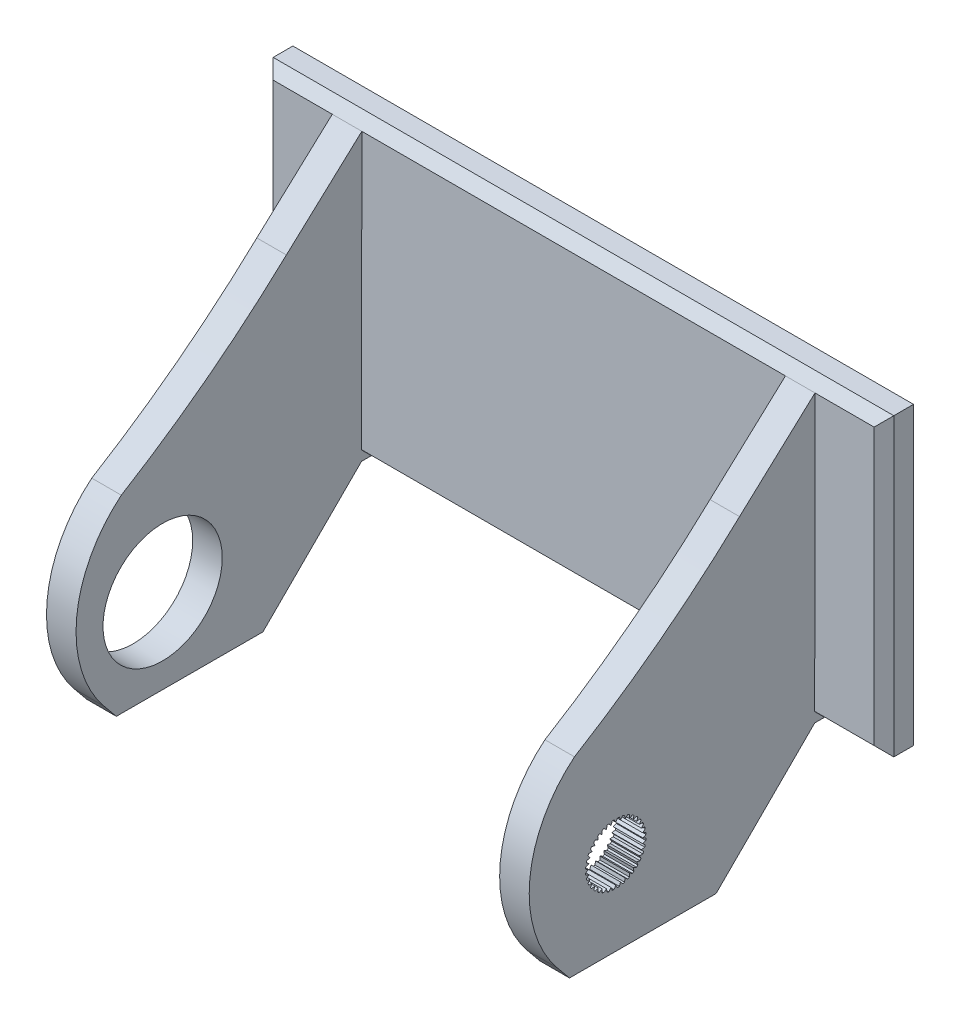
from build123d import *

# Parameters (mm, degrees)
SKETCH2_W           = 63
SKETCH2_H           = 30
BOSS_EXTRUDE2_DEPTH = 3
CHAMFER2_SIZE       = 1
BOSS_EXTRUDE9_DEPTH = 3
CUT_EXTRUDE5_DEPTH  = 5
SKETCH16_R          = 6.05
CUT_EXTRUDE6_DEPTH  = 10


with BuildPart() as part:
    # Sketch2 → Boss-Extrude2 (new body)
    with BuildSketch(Plane.XY):
        Rectangle(SKETCH2_W, SKETCH2_H)
    extrude(amount=BOSS_EXTRUDE2_DEPTH)

    # Chamfer2
    chamfer2_edges = [part.edges().sort_by_distance(p)[0] for p in [
        (31.5, 0, 3),
        (0, 15, 3),
        (-31.5, 0, 3),
        (0, -15, 3),
    ]]
    chamfer(chamfer2_edges, length=CHAMFER2_SIZE)

    # Sketch13 → Boss-Extrude9 (add)
    with BuildSketch(Plane(origin=(24.5, 0, 0), x_dir=(0, 0, -1), z_dir=(1, 0, 0))):
        with BuildLine():
            Line((-10.660322202, 6.959525665), (-2.998872345, 14.001126385))
            Line((-2.998872345, 14.001126385), (-3.030428908, -13.998855833))
            Line((-3.030428908, -13.998855833), (-2.031556563, -14.999982218))
            Line((-2.031556563, -14.999982218), (-3.031555928, -14.998855197))
            Line((-3.031555928, -14.998855197), (-13.042819779, -24.987578645))
            Line((-13.042819779, -24.987578645), (-27.921026388, -24.970810597))
            Line((-27.921026388, -24.970810597), (-29.162872651, -23.456276379))
            ThreePointArc((-29.162872651, -23.456276379), (-31.949395463, -14.255966479), (-27.41416312, -5.779995783))
            ThreePointArc((-27.41416312, -5.779995783), (-18.704473898, 0.152138226), (-10.660322202, 6.959525665))
        make_face()
    boss_extrude9 = extrude(amount=-BOSS_EXTRUDE9_DEPTH)

    # Sketch15 → Cut-Extrude5 (cut)
    with BuildSketch(Plane(origin=(24.5, 0, 0), x_dir=(0, 0, -1), z_dir=(1, 0, 0))):
        with BuildLine():
            Line((-20.762578121, -14.904937587), (-20.716266214, -14.82472301))
            Line((-20.716266214, -14.82472301), (-20.652589668, -14.714431997))
            ThreePointArc((-20.652589668, -14.714431997), (-20.706229612, -14.635227935), (-20.762311144, -14.55773349))
            Line((-20.762311144, -14.55773349), (-20.887729456, -14.579848123))
            Line((-20.887729456, -14.579848123), (-20.978946107, -14.595932079))
            Line((-20.978946107, -14.595932079), (-21.101391144, -14.617522443))
            Line((-21.101391144, -14.617522443), (-21.058866429, -14.500686748))
            Line((-21.058866429, -14.500686748), (-21.027187219, -14.413648833))
            Line((-21.027187219, -14.413648833), (-20.983629896, -14.293976072))
            ThreePointArc((-20.983629896, -14.293976072), (-21.05020857, -14.225289776), (-21.118894866, -14.158711102))
            Line((-21.118894866, -14.158711102), (-21.238567627, -14.202268425))
            Line((-21.238567627, -14.202268425), (-21.325605542, -14.233947635))
            Line((-21.325605542, -14.233947635), (-21.442441237, -14.276472351))
            Line((-21.442441237, -14.276472351), (-21.420850873, -14.154027313))
            Line((-21.420850873, -14.154027313), (-21.404766916, -14.062810662))
            Line((-21.404766916, -14.062810662), (-21.382652284, -13.93739235))
            ThreePointArc((-21.382652284, -13.93739235), (-21.460146729, -13.881310819), (-21.539350791, -13.827670874))
            Line((-21.539350791, -13.827670874), (-21.649641804, -13.89134742))
            Line((-21.649641804, -13.89134742), (-21.72985638, -13.937659328))
            Line((-21.72985638, -13.937659328), (-21.837532739, -13.999826302))
            Line((-21.837532739, -13.999826302), (-21.837532739, -13.875492353))
            Line((-21.837532739, -13.875492353), (-21.837532739, -13.782868538))
            Line((-21.837532739, -13.782868538), (-21.837532739, -13.655515446))
            ThreePointArc((-21.837532739, -13.655515446), (-21.923588325, -13.613742688), (-22.010903578, -13.574671296))
            Line((-22.010903578, -13.574671296), (-22.108461706, -13.656532286))
            Line((-22.108461706, -13.656532286), (-22.179415665, -13.716069726))
            Line((-22.179415665, -13.716069726), (-22.274660996, -13.795990049))
            Line((-22.274660996, -13.795990049), (-22.29625136, -13.673545011))
            Line((-22.29625136, -13.673545011), (-22.312335316, -13.58232836))
            Line((-22.312335316, -13.58232836), (-22.334449949, -13.456910048))
            ThreePointArc((-22.334449949, -13.456910048), (-22.42645192, -13.430715308), (-22.519225334, -13.407399633))
            Line((-22.519225334, -13.407399633), (-22.601086323, -13.504957761))
            Line((-22.601086323, -13.504957761), (-22.660623764, -13.57591172))
            Line((-22.660623764, -13.57591172), (-22.740544086, -13.671157051))
            Line((-22.740544086, -13.671157051), (-22.783068801, -13.554321356))
            Line((-22.783068801, -13.554321356), (-22.814748012, -13.467283441))
            Line((-22.814748012, -13.467283441), (-22.858305335, -13.34761068))
            ThreePointArc((-22.858305335, -13.34761068), (-22.953458258, -13.337789871), (-23.04887096, -13.330938348))
            Line((-23.04887096, -13.330938348), (-23.112547506, -13.441229361))
            Line((-23.112547506, -13.441229361), (-23.158859413, -13.521443937))
            Line((-23.158859413, -13.521443937), (-23.221026388, -13.629120296))
            Line((-23.221026388, -13.629120296), (-23.283193363, -13.521443937))
            Line((-23.283193363, -13.521443937), (-23.32950527, -13.441229361))
            Line((-23.32950527, -13.441229361), (-23.393181816, -13.330938348))
            ThreePointArc((-23.393181816, -13.330938348), (-23.488594518, -13.337789871), (-23.583747442, -13.34761068))
            Line((-23.583747442, -13.34761068), (-23.627304764, -13.467283441))
            Line((-23.627304764, -13.467283441), (-23.658983975, -13.554321356))
            Line((-23.658983975, -13.554321356), (-23.70150869, -13.671157051))
            Line((-23.70150869, -13.671157051), (-23.781429012, -13.57591172))
            Line((-23.781429012, -13.57591172), (-23.840966453, -13.504957761))
            Line((-23.840966453, -13.504957761), (-23.922827442, -13.407399633))
            ThreePointArc((-23.922827442, -13.407399633), (-24.015600857, -13.430715308), (-24.107602828, -13.456910048))
            Line((-24.107602828, -13.456910048), (-24.12971746, -13.58232836))
            Line((-24.12971746, -13.58232836), (-24.145801417, -13.673545011))
            Line((-24.145801417, -13.673545011), (-24.16739178, -13.795990049))
            Line((-24.16739178, -13.795990049), (-24.262637112, -13.716069726))
            Line((-24.262637112, -13.716069726), (-24.33359107, -13.656532286))
            Line((-24.33359107, -13.656532286), (-24.431149198, -13.574671296))
            ThreePointArc((-24.431149198, -13.574671296), (-24.518464452, -13.613742688), (-24.604520037, -13.655515446))
            Line((-24.604520037, -13.655515446), (-24.604520037, -13.782868538))
            Line((-24.604520037, -13.782868538), (-24.604520037, -13.875492353))
            Line((-24.604520037, -13.875492353), (-24.604520037, -13.999826302))
            Line((-24.604520037, -13.999826302), (-24.712196396, -13.937659328))
            Line((-24.712196396, -13.937659328), (-24.792410973, -13.89134742))
            Line((-24.792410973, -13.89134742), (-24.902701985, -13.827670874))
            ThreePointArc((-24.902701985, -13.827670874), (-24.981906048, -13.881310819), (-25.059400492, -13.93739235))
            Line((-25.059400492, -13.93739235), (-25.03728586, -14.062810662))
            Line((-25.03728586, -14.062810662), (-25.021201903, -14.154027313))
            Line((-25.021201903, -14.154027313), (-24.99961154, -14.276472351))
            Line((-24.99961154, -14.276472351), (-25.116447234, -14.233947635))
            Line((-25.116447234, -14.233947635), (-25.20348515, -14.202268425))
            Line((-25.20348515, -14.202268425), (-25.32315791, -14.158711102))
            ThreePointArc((-25.32315791, -14.158711102), (-25.391844206, -14.225289776), (-25.45842288, -14.293976072))
            Line((-25.45842288, -14.293976072), (-25.414865558, -14.413648833))
            Line((-25.414865558, -14.413648833), (-25.383186347, -14.500686748))
            Line((-25.383186347, -14.500686748), (-25.340661632, -14.617522443))
            Line((-25.340661632, -14.617522443), (-25.46310667, -14.595932079))
            Line((-25.46310667, -14.595932079), (-25.55432332, -14.579848123))
            Line((-25.55432332, -14.579848123), (-25.679741633, -14.55773349))
            ThreePointArc((-25.679741633, -14.55773349), (-25.735823164, -14.635227935), (-25.789463108, -14.714431997))
            Line((-25.789463108, -14.714431997), (-25.725786562, -14.82472301))
            Line((-25.725786562, -14.82472301), (-25.679474655, -14.904937587))
            Line((-25.679474655, -14.904937587), (-25.61730768, -15.012613945))
            Line((-25.61730768, -15.012613945), (-25.74164163, -15.012613945))
            Line((-25.74164163, -15.012613945), (-25.834265445, -15.012613945))
            Line((-25.834265445, -15.012613945), (-25.961618536, -15.012613945))
            ThreePointArc((-25.961618536, -15.012613945), (-26.003391294, -15.098669531), (-26.042462686, -15.185984784))
            Line((-26.042462686, -15.185984784), (-25.960601697, -15.283542912))
            Line((-25.960601697, -15.283542912), (-25.901064256, -15.354496871))
            Line((-25.901064256, -15.354496871), (-25.821143934, -15.449742202))
            Line((-25.821143934, -15.449742202), (-25.943588972, -15.471332566))
            Line((-25.943588972, -15.471332566), (-26.034805622, -15.487416523))
            Line((-26.034805622, -15.487416523), (-26.160223935, -15.509531155))
            ThreePointArc((-26.160223935, -15.509531155), (-26.186418675, -15.601533126), (-26.20973435, -15.69430654))
            Line((-26.20973435, -15.69430654), (-26.112176222, -15.77616753))
            Line((-26.112176222, -15.77616753), (-26.041222263, -15.83570497))
            Line((-26.041222263, -15.83570497), (-25.945976932, -15.915625293))
            Line((-25.945976932, -15.915625293), (-26.062812627, -15.958150008))
            Line((-26.062812627, -15.958150008), (-26.149850542, -15.989829218))
            Line((-26.149850542, -15.989829218), (-26.269523303, -16.033386541))
            ThreePointArc((-26.269523303, -16.033386541), (-26.279344111, -16.128539464), (-26.286195634, -16.223952166))
            Line((-26.286195634, -16.223952166), (-26.175904622, -16.287628712))
            Line((-26.175904622, -16.287628712), (-26.095690045, -16.33394062))
            Line((-26.095690045, -16.33394062), (-25.988013686, -16.396107594))
            Line((-25.988013686, -16.396107594), (-26.095690045, -16.458274569))
            Line((-26.095690045, -16.458274569), (-26.175904622, -16.504586477))
            Line((-26.175904622, -16.504586477), (-26.286195634, -16.568263023))
            ThreePointArc((-26.286195634, -16.568263023), (-26.279344111, -16.663675725), (-26.269523303, -16.758828648))
            Line((-26.269523303, -16.758828648), (-26.149850542, -16.802385971))
            Line((-26.149850542, -16.802385971), (-26.062812627, -16.834065181))
            Line((-26.062812627, -16.834065181), (-25.945976932, -16.876589896))
            Line((-25.945976932, -16.876589896), (-26.041222263, -16.956510219))
            Line((-26.041222263, -16.956510219), (-26.112176222, -17.016047659))
            Line((-26.112176222, -17.016047659), (-26.20973435, -17.097908649))
            ThreePointArc((-26.20973435, -17.097908649), (-26.186418675, -17.190682063), (-26.160223935, -17.282684034))
            Line((-26.160223935, -17.282684034), (-26.034805622, -17.304798666))
            Line((-26.034805622, -17.304798666), (-25.943588972, -17.320882623))
            Line((-25.943588972, -17.320882623), (-25.821143934, -17.342472987))
            Line((-25.821143934, -17.342472987), (-25.901064256, -17.437718318))
            Line((-25.901064256, -17.437718318), (-25.960601697, -17.508672277))
            Line((-25.960601697, -17.508672277), (-26.042462686, -17.606230405))
            ThreePointArc((-26.042462686, -17.606230405), (-26.003391294, -17.693545658), (-25.961618536, -17.779601244))
            Line((-25.961618536, -17.779601244), (-25.834265445, -17.779601244))
            Line((-25.834265445, -17.779601244), (-25.74164163, -17.779601244))
            Line((-25.74164163, -17.779601244), (-25.61730768, -17.779601244))
            Line((-25.61730768, -17.779601244), (-25.679474655, -17.887277602))
            Line((-25.679474655, -17.887277602), (-25.725786562, -17.967492179))
            Line((-25.725786562, -17.967492179), (-25.789463108, -18.077783192))
            ThreePointArc((-25.789463108, -18.077783192), (-25.735823164, -18.156987254), (-25.679741633, -18.234481699))
            Line((-25.679741633, -18.234481699), (-25.55432332, -18.212367066))
            Line((-25.55432332, -18.212367066), (-25.46310667, -18.19628311))
            Line((-25.46310667, -18.19628311), (-25.340661632, -18.174692746))
            Line((-25.340661632, -18.174692746), (-25.383186347, -18.291528441))
            Line((-25.383186347, -18.291528441), (-25.414865558, -18.378566356))
            Line((-25.414865558, -18.378566356), (-25.45842288, -18.498239117))
            ThreePointArc((-25.45842288, -18.498239117), (-25.391844206, -18.566925413), (-25.32315791, -18.633504087))
            Line((-25.32315791, -18.633504087), (-25.20348515, -18.589946764))
            Line((-25.20348515, -18.589946764), (-25.116447234, -18.558267554))
            Line((-25.116447234, -18.558267554), (-24.99961154, -18.515742838))
            Line((-24.99961154, -18.515742838), (-25.021201903, -18.638187876))
            Line((-25.021201903, -18.638187876), (-25.03728586, -18.729404527))
            Line((-25.03728586, -18.729404527), (-25.059400492, -18.854822839))
            ThreePointArc((-25.059400492, -18.854822839), (-24.981906048, -18.91090437), (-24.902701985, -18.964544315))
            Line((-24.902701985, -18.964544315), (-24.792410973, -18.900867769))
            Line((-24.792410973, -18.900867769), (-24.712196396, -18.854555861))
            Line((-24.712196396, -18.854555861), (-24.604520037, -18.792388887))
            Line((-24.604520037, -18.792388887), (-24.604520037, -18.916722836))
            Line((-24.604520037, -18.916722836), (-24.604520037, -19.009346651))
            Line((-24.604520037, -19.009346651), (-24.604520037, -19.136699743))
            ThreePointArc((-24.604520037, -19.136699743), (-24.518464452, -19.178472501), (-24.431149198, -19.217543893))
            Line((-24.431149198, -19.217543893), (-24.33359107, -19.135682903))
            Line((-24.33359107, -19.135682903), (-24.262637112, -19.076145463))
            Line((-24.262637112, -19.076145463), (-24.16739178, -18.99622514))
            Line((-24.16739178, -18.99622514), (-24.145801417, -19.118670178))
            Line((-24.145801417, -19.118670178), (-24.12971746, -19.209886829))
            Line((-24.12971746, -19.209886829), (-24.107602828, -19.335305141))
            ThreePointArc((-24.107602828, -19.335305141), (-24.015600857, -19.361499881), (-23.922827442, -19.384815556))
            Line((-23.922827442, -19.384815556), (-23.840966453, -19.287257428))
            Line((-23.840966453, -19.287257428), (-23.781429012, -19.216303469))
            Line((-23.781429012, -19.216303469), (-23.70150869, -19.121058138))
            Line((-23.70150869, -19.121058138), (-23.658983975, -19.237893833))
            Line((-23.658983975, -19.237893833), (-23.627304764, -19.324931748))
            Line((-23.627304764, -19.324931748), (-23.583747442, -19.444604509))
            ThreePointArc((-23.583747442, -19.444604509), (-23.488594518, -19.454425318), (-23.393181816, -19.461276841))
            Line((-23.393181816, -19.461276841), (-23.32950527, -19.350985828))
            Line((-23.32950527, -19.350985828), (-23.283193363, -19.270771251))
            Line((-23.283193363, -19.270771251), (-23.221026388, -19.163094893))
            Line((-23.221026388, -19.163094893), (-23.158859413, -19.270771251))
            Line((-23.158859413, -19.270771251), (-23.112547506, -19.350985828))
            Line((-23.112547506, -19.350985828), (-23.04887096, -19.461276841))
            ThreePointArc((-23.04887096, -19.461276841), (-22.953458258, -19.454425318), (-22.858305335, -19.444604509))
            Line((-22.858305335, -19.444604509), (-22.814748012, -19.324931748))
            Line((-22.814748012, -19.324931748), (-22.783068801, -19.237893833))
            Line((-22.783068801, -19.237893833), (-22.740544086, -19.121058138))
            Line((-22.740544086, -19.121058138), (-22.660623764, -19.216303469))
            Line((-22.660623764, -19.216303469), (-22.601086323, -19.287257428))
            Line((-22.601086323, -19.287257428), (-22.519225334, -19.384815556))
            ThreePointArc((-22.519225334, -19.384815556), (-22.42645192, -19.361499881), (-22.334449949, -19.335305141))
            Line((-22.334449949, -19.335305141), (-22.312335316, -19.209886829))
            Line((-22.312335316, -19.209886829), (-22.29625136, -19.118670178))
            Line((-22.29625136, -19.118670178), (-22.274660996, -18.99622514))
            Line((-22.274660996, -18.99622514), (-22.179415665, -19.076145463))
            Line((-22.179415665, -19.076145463), (-22.108461706, -19.135682903))
            Line((-22.108461706, -19.135682903), (-22.010903578, -19.217543893))
            ThreePointArc((-22.010903578, -19.217543893), (-21.923588325, -19.178472501), (-21.837532739, -19.136699743))
            Line((-21.837532739, -19.136699743), (-21.837532739, -19.009346651))
            Line((-21.837532739, -19.009346651), (-21.837532739, -18.916722836))
            Line((-21.837532739, -18.916722836), (-21.837532739, -18.792388887))
            Line((-21.837532739, -18.792388887), (-21.72985638, -18.854555861))
            Line((-21.72985638, -18.854555861), (-21.649641804, -18.900867769))
            Line((-21.649641804, -18.900867769), (-21.539350791, -18.964544315))
            ThreePointArc((-21.539350791, -18.964544315), (-21.460146729, -18.91090437), (-21.382652284, -18.854822839))
            Line((-21.382652284, -18.854822839), (-21.404766916, -18.729404527))
            Line((-21.404766916, -18.729404527), (-21.420850873, -18.638187876))
            Line((-21.420850873, -18.638187876), (-21.442441237, -18.515742838))
            Line((-21.442441237, -18.515742838), (-21.325605542, -18.558267554))
            Line((-21.325605542, -18.558267554), (-21.238567627, -18.589946764))
            Line((-21.238567627, -18.589946764), (-21.118894866, -18.633504087))
            ThreePointArc((-21.118894866, -18.633504087), (-21.05020857, -18.566925413), (-20.983629896, -18.498239117))
            Line((-20.983629896, -18.498239117), (-21.027187219, -18.378566356))
            Line((-21.027187219, -18.378566356), (-21.058866429, -18.291528441))
            Line((-21.058866429, -18.291528441), (-21.101391144, -18.174692746))
            Line((-21.101391144, -18.174692746), (-20.978946107, -18.19628311))
            Line((-20.978946107, -18.19628311), (-20.887729456, -18.212367066))
            Line((-20.887729456, -18.212367066), (-20.762311144, -18.234481699))
            ThreePointArc((-20.762311144, -18.234481699), (-20.706229612, -18.156987254), (-20.652589668, -18.077783192))
            Line((-20.652589668, -18.077783192), (-20.716266214, -17.967492179))
            Line((-20.716266214, -17.967492179), (-20.762578121, -17.887277602))
            Line((-20.762578121, -17.887277602), (-20.824745096, -17.779601244))
            Line((-20.824745096, -17.779601244), (-20.700411146, -17.779601244))
            Line((-20.700411146, -17.779601244), (-20.607787332, -17.779601244))
            Line((-20.607787332, -17.779601244), (-20.48043424, -17.779601244))
            ThreePointArc((-20.48043424, -17.779601244), (-20.438661482, -17.693545658), (-20.39959009, -17.606230405))
            Line((-20.39959009, -17.606230405), (-20.48145108, -17.508672277))
            Line((-20.48145108, -17.508672277), (-20.54098852, -17.437718318))
            Line((-20.54098852, -17.437718318), (-20.620908842, -17.342472987))
            Line((-20.620908842, -17.342472987), (-20.498463805, -17.320882623))
            Line((-20.498463805, -17.320882623), (-20.407247154, -17.304798666))
            Line((-20.407247154, -17.304798666), (-20.281828842, -17.282684034))
            ThreePointArc((-20.281828842, -17.282684034), (-20.255634101, -17.190682063), (-20.232318426, -17.097908649))
            Line((-20.232318426, -17.097908649), (-20.329876555, -17.016047659))
            Line((-20.329876555, -17.016047659), (-20.400830513, -16.956510219))
            Line((-20.400830513, -16.956510219), (-20.496075844, -16.876589896))
            Line((-20.496075844, -16.876589896), (-20.37924015, -16.834065181))
            Line((-20.37924015, -16.834065181), (-20.292202234, -16.802385971))
            Line((-20.292202234, -16.802385971), (-20.172529474, -16.758828648))
            ThreePointArc((-20.172529474, -16.758828648), (-20.162708665, -16.663675725), (-20.155857142, -16.568263023))
            Line((-20.155857142, -16.568263023), (-20.266148155, -16.504586477))
            Line((-20.266148155, -16.504586477), (-20.346362731, -16.458274569))
            Line((-20.346362731, -16.458274569), (-20.45403909, -16.396107594))
            Line((-20.45403909, -16.396107594), (-20.346362731, -16.33394062))
            Line((-20.346362731, -16.33394062), (-20.266148155, -16.287628712))
            Line((-20.266148155, -16.287628712), (-20.155857142, -16.223952166))
            ThreePointArc((-20.155857142, -16.223952166), (-20.162708665, -16.128539464), (-20.172529474, -16.033386541))
            Line((-20.172529474, -16.033386541), (-20.292202234, -15.989829218))
            Line((-20.292202234, -15.989829218), (-20.37924015, -15.958150008))
            Line((-20.37924015, -15.958150008), (-20.496075844, -15.915625293))
            Line((-20.496075844, -15.915625293), (-20.400830513, -15.83570497))
            Line((-20.400830513, -15.83570497), (-20.329876555, -15.77616753))
            Line((-20.329876555, -15.77616753), (-20.232318426, -15.69430654))
            ThreePointArc((-20.232318426, -15.69430654), (-20.255634101, -15.601533126), (-20.281828842, -15.509531155))
            Line((-20.281828842, -15.509531155), (-20.407247154, -15.487416523))
            Line((-20.407247154, -15.487416523), (-20.498463805, -15.471332566))
            Line((-20.498463805, -15.471332566), (-20.620908842, -15.449742202))
            Line((-20.620908842, -15.449742202), (-20.54098852, -15.354496871))
            Line((-20.54098852, -15.354496871), (-20.48145108, -15.283542912))
            Line((-20.48145108, -15.283542912), (-20.39959009, -15.185984784))
            ThreePointArc((-20.39959009, -15.185984784), (-20.438661482, -15.098669531), (-20.48043424, -15.012613945))
            Line((-20.48043424, -15.012613945), (-20.607787332, -15.012613945))
            Line((-20.607787332, -15.012613945), (-20.700411146, -15.012613945))
            Line((-20.700411146, -15.012613945), (-20.824745096, -15.012613945))
            Line((-20.824745096, -15.012613945), (-20.762578121, -14.904937587))
        make_face()
    extrude(amount=-CUT_EXTRUDE5_DEPTH, mode=Mode.SUBTRACT)

    # Mirror1: Boss-Extrude9 across plane
    add(boss_extrude9.mirror(Plane(origin=(0, 0, 0), x_dir=(0, 0, 1), z_dir=(1, 0, 0))))

    # Sketch16 → Cut-Extrude6 (cut)
    with BuildSketch(Plane(origin=(-21.5, 0, 0), x_dir=(0, 0, -1), z_dir=(1, 0, 0))):
        with Locations((-23.221026388, -16.396107594)):
            Circle(SKETCH16_R)
    extrude(amount=-CUT_EXTRUDE6_DEPTH, mode=Mode.SUBTRACT)


solid = part.part
